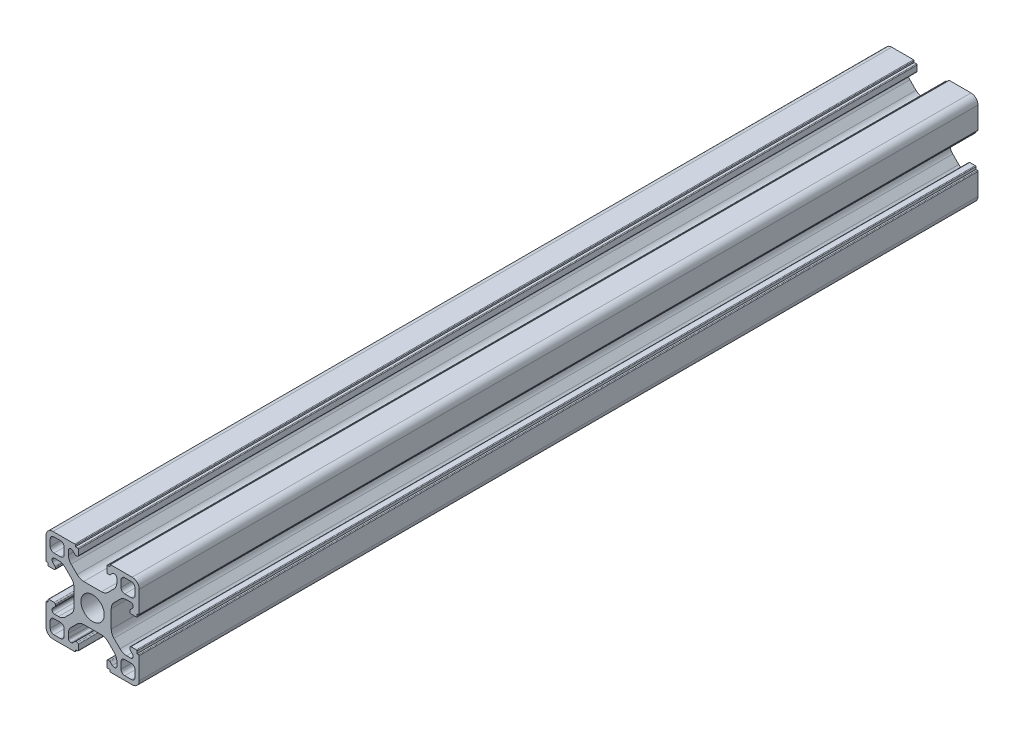
from build123d import *

# Parameters (mm, degrees)
EXTRUDE_1_DEPTH = 180


with BuildPart() as part:
    # Эскиз1 → Бобышка-Вытянуть1 (new body)
    with BuildSketch(Plane.XY):
        with BuildLine():
            Line((-31.105150957, 65.209647948), (-29.206370287, 65.209647948))
            ThreePointArc((-29.206370287, 65.209647948), (-28.441003423, 65.361888883), (-27.792156725, 65.795434385))
            Line((-27.792156725, 65.795434385), (-26.490937394, 67.096653716))
            ThreePointArc((-26.490937394, 67.096653716), (-26.057391892, 67.745500414), (-25.905150957, 68.510867279))
            Line((-25.905150957, 68.510867279), (-25.905150957, 69.409647948))
            ThreePointArc((-25.905150957, 69.409647948), (-26.051597566, 69.763201338), (-26.405150957, 69.909647948))
            Line((-26.405150957, 69.909647948), (-26.508044175, 69.909647948))
            ThreePointArc((-26.508044175, 69.909647948), (-26.699385892, 69.871587714), (-26.861597566, 69.763201338))
            Line((-26.861597566, 69.763201338), (-27.341927652, 69.282871252))
            ThreePointArc((-27.341927652, 69.282871252), (-27.423033489, 69.228678065), (-27.518704347, 69.209647948))
            Line((-27.518704347, 69.209647948), (-27.805150957, 69.209647948))
            ThreePointArc((-27.805150957, 69.209647948), (-27.981927652, 69.282871252), (-28.055150957, 69.459647948))
            Line((-28.055150957, 69.459647948), (-28.055150957, 70.608718768))
            ThreePointArc((-28.055150957, 70.608718768), (-28.011216974, 70.714784785), (-27.905150957, 70.758718768))
            Line((-27.905150957, 70.758718768), (-27.405150957, 70.758718768))
            Line((-27.405150957, 70.758718768), (-27.405150957, 71.059647948))
            ThreePointArc((-27.405150957, 71.059647948), (-27.361216974, 71.165713965), (-27.255150957, 71.209647948))
            Line((-27.255150957, 71.209647948), (-22.605150957, 71.209647948))
            ThreePointArc((-22.605150957, 71.209647948), (-21.544490785, 70.770308119), (-21.105150957, 69.709647948))
            Line((-21.105150957, 69.709647948), (-21.105150957, 65.059647948))
            ThreePointArc((-21.105150957, 65.059647948), (-21.149084939, 64.953581931), (-21.255150957, 64.909647948))
            Line((-21.255150957, 64.909647948), (-21.556080136, 64.909647948))
            Line((-21.556080136, 64.909647948), (-21.556080136, 64.409647948))
            ThreePointArc((-21.556080136, 64.409647948), (-21.600014119, 64.303581931), (-21.706080136, 64.259647948))
            Line((-21.706080136, 64.259647948), (-22.855150957, 64.259647948))
            ThreePointArc((-22.855150957, 64.259647948), (-23.031927652, 64.332871252), (-23.105150957, 64.509647948))
            Line((-23.105150957, 64.509647948), (-23.105150957, 64.796094557))
            ThreePointArc((-23.105150957, 64.796094557), (-23.08612084, 64.891765415), (-23.031927652, 64.972871252))
            Line((-23.031927652, 64.972871252), (-22.551597566, 65.453201338))
            ThreePointArc((-22.551597566, 65.453201338), (-22.44321119, 65.615413013), (-22.405150957, 65.806754729))
            Line((-22.405150957, 65.806754729), (-22.405150957, 65.909647948))
            ThreePointArc((-22.405150957, 65.909647948), (-22.551597566, 66.263201338), (-22.905150957, 66.409647948))
            Line((-22.905150957, 66.409647948), (-23.803931626, 66.409647948))
            ThreePointArc((-23.803931626, 66.409647948), (-24.56929849, 66.257407013), (-25.218145188, 65.82386151))
            Line((-25.218145188, 65.82386151), (-26.519364519, 64.522642179))
            ThreePointArc((-26.519364519, 64.522642179), (-26.952910022, 63.873795482), (-27.105150957, 63.108428617))
            Line((-27.105150957, 63.108428617), (-27.105150957, 61.209647948))
            Line((-27.105150957, 61.209647948), (-27.105150957, 59.310867279))
            ThreePointArc((-27.105150957, 59.310867279), (-26.952910022, 58.545500414), (-26.519364519, 57.896653716))
            Line((-26.519364519, 57.896653716), (-25.218145188, 56.595434385))
            ThreePointArc((-25.218145188, 56.595434385), (-24.56929849, 56.161888883), (-23.803931626, 56.009647948))
            Line((-23.803931626, 56.009647948), (-22.905150957, 56.009647948))
            ThreePointArc((-22.905150957, 56.009647948), (-22.551597566, 56.156094557), (-22.405150957, 56.509647948))
            Line((-22.405150957, 56.509647948), (-22.405150957, 56.612541166))
            ThreePointArc((-22.405150957, 56.612541166), (-22.44321119, 56.803882883), (-22.551597566, 56.966094557))
            Line((-22.551597566, 56.966094557), (-23.031927652, 57.446424643))
            ThreePointArc((-23.031927652, 57.446424643), (-23.08612084, 57.52753048), (-23.105150957, 57.623201338))
            Line((-23.105150957, 57.623201338), (-23.105150957, 57.909647948))
            ThreePointArc((-23.105150957, 57.909647948), (-23.031927652, 58.086424643), (-22.855150957, 58.159647948))
            Line((-22.855150957, 58.159647948), (-21.706080136, 58.159647948))
            ThreePointArc((-21.706080136, 58.159647948), (-21.600014119, 58.115713965), (-21.556080136, 58.009647948))
            Line((-21.556080136, 58.009647948), (-21.556080136, 57.509647948))
            Line((-21.556080136, 57.509647948), (-21.255150957, 57.509647948))
            ThreePointArc((-21.255150957, 57.509647948), (-21.149084939, 57.465713965), (-21.105150957, 57.359647948))
            Line((-21.105150957, 57.359647948), (-21.105150957, 52.709647948))
            ThreePointArc((-21.105150957, 52.709647948), (-21.544490785, 51.648987776), (-22.605150957, 51.209647948))
            Line((-22.605150957, 51.209647948), (-27.255150957, 51.209647948))
            ThreePointArc((-27.255150957, 51.209647948), (-27.361216974, 51.253581931), (-27.405150957, 51.359647948))
            Line((-27.405150957, 51.359647948), (-27.405150957, 51.660577127))
            Line((-27.405150957, 51.660577127), (-27.905150957, 51.660577127))
            ThreePointArc((-27.905150957, 51.660577127), (-28.011216974, 51.70451111), (-28.055150957, 51.810577127))
            Line((-28.055150957, 51.810577127), (-28.055150957, 52.959647948))
            ThreePointArc((-28.055150957, 52.959647948), (-27.981927652, 53.136424643), (-27.805150957, 53.209647948))
            Line((-27.805150957, 53.209647948), (-27.518704347, 53.209647948))
            ThreePointArc((-27.518704347, 53.209647948), (-27.423033489, 53.190617831), (-27.341927652, 53.136424643))
            Line((-27.341927652, 53.136424643), (-26.861597566, 52.656094557))
            ThreePointArc((-26.861597566, 52.656094557), (-26.699385892, 52.547708181), (-26.508044175, 52.509647948))
            Line((-26.508044175, 52.509647948), (-26.405150957, 52.509647948))
            ThreePointArc((-26.405150957, 52.509647948), (-26.051597566, 52.656094557), (-25.905150957, 53.009647948))
            Line((-25.905150957, 53.009647948), (-25.905150957, 53.908428617))
            ThreePointArc((-25.905150957, 53.908428617), (-26.057391892, 54.673795482), (-26.490937394, 55.322642179))
            Line((-26.490937394, 55.322642179), (-27.792156725, 56.62386151))
            ThreePointArc((-27.792156725, 56.62386151), (-28.441003423, 57.057407013), (-29.206370287, 57.209647948))
            Line((-29.206370287, 57.209647948), (-31.105150957, 57.209647948))
            Line((-31.105150957, 57.209647948), (-33.003931626, 57.209647948))
            ThreePointArc((-33.003931626, 57.209647948), (-33.76929849, 57.057407013), (-34.418145188, 56.62386151))
            Line((-34.418145188, 56.62386151), (-35.719364519, 55.322642179))
            ThreePointArc((-35.719364519, 55.322642179), (-36.152910022, 54.673795482), (-36.305150957, 53.908428617))
            Line((-36.305150957, 53.908428617), (-36.305150957, 53.009647948))
            ThreePointArc((-36.305150957, 53.009647948), (-36.158704347, 52.656094557), (-35.805150957, 52.509647948))
            Line((-35.805150957, 52.509647948), (-35.702257738, 52.509647948))
            ThreePointArc((-35.702257738, 52.509647948), (-35.510916022, 52.547708181), (-35.348704347, 52.656094557))
            Line((-35.348704347, 52.656094557), (-34.868374261, 53.136424643))
            ThreePointArc((-34.868374261, 53.136424643), (-34.787268424, 53.190617831), (-34.691597566, 53.209647948))
            Line((-34.691597566, 53.209647948), (-34.405150957, 53.209647948))
            ThreePointArc((-34.405150957, 53.209647948), (-34.228374261, 53.136424643), (-34.155150957, 52.959647948))
            Line((-34.155150957, 52.959647948), (-34.155150957, 51.810577127))
            ThreePointArc((-34.155150957, 51.810577127), (-34.199084939, 51.70451111), (-34.305150957, 51.660577127))
            Line((-34.305150957, 51.660577127), (-34.805150957, 51.660577127))
            Line((-34.805150957, 51.660577127), (-34.805150957, 51.359647948))
            ThreePointArc((-34.805150957, 51.359647948), (-34.849084939, 51.253581931), (-34.955150957, 51.209647948))
            Line((-34.955150957, 51.209647948), (-39.605150957, 51.209647948))
            ThreePointArc((-39.605150957, 51.209647948), (-40.665811128, 51.648987776), (-41.105150957, 52.709647948))
            Line((-41.105150957, 52.709647948), (-41.105150957, 57.359647948))
            ThreePointArc((-41.105150957, 57.359647948), (-41.061216974, 57.465713965), (-40.955150957, 57.509647948))
            Line((-40.955150957, 57.509647948), (-40.654221777, 57.509647948))
            Line((-40.654221777, 57.509647948), (-40.654221777, 58.009647948))
            ThreePointArc((-40.654221777, 58.009647948), (-40.610287794, 58.115713965), (-40.504221777, 58.159647948))
            Line((-40.504221777, 58.159647948), (-39.355150957, 58.159647948))
            ThreePointArc((-39.355150957, 58.159647948), (-39.178374261, 58.086424643), (-39.105150957, 57.909647948))
            Line((-39.105150957, 57.909647948), (-39.105150957, 57.623201338))
            ThreePointArc((-39.105150957, 57.623201338), (-39.124181073, 57.52753048), (-39.178374261, 57.446424643))
            Line((-39.178374261, 57.446424643), (-39.658704347, 56.966094557))
            ThreePointArc((-39.658704347, 56.966094557), (-39.767090723, 56.803882883), (-39.805150957, 56.612541166))
            Line((-39.805150957, 56.612541166), (-39.805150957, 56.509647948))
            ThreePointArc((-39.805150957, 56.509647948), (-39.658704347, 56.156094557), (-39.305150957, 56.009647948))
            Line((-39.305150957, 56.009647948), (-38.406370287, 56.009647948))
            ThreePointArc((-38.406370287, 56.009647948), (-37.641003423, 56.161888883), (-36.992156725, 56.595434385))
            Line((-36.992156725, 56.595434385), (-35.690937394, 57.896653716))
            ThreePointArc((-35.690937394, 57.896653716), (-35.257391892, 58.545500414), (-35.105150957, 59.310867279))
            Line((-35.105150957, 59.310867279), (-35.105150957, 61.209647948))
            Line((-35.105150957, 61.209647948), (-35.105150957, 63.108428617))
            ThreePointArc((-35.105150957, 63.108428617), (-35.257391892, 63.873795482), (-35.690937394, 64.522642179))
            Line((-35.690937394, 64.522642179), (-36.992156725, 65.82386151))
            ThreePointArc((-36.992156725, 65.82386151), (-37.641003423, 66.257407013), (-38.406370287, 66.409647948))
            Line((-38.406370287, 66.409647948), (-39.305150957, 66.409647948))
            ThreePointArc((-39.305150957, 66.409647948), (-39.658704347, 66.263201338), (-39.805150957, 65.909647948))
            Line((-39.805150957, 65.909647948), (-39.805150957, 65.806754729))
            ThreePointArc((-39.805150957, 65.806754729), (-39.767090723, 65.615413013), (-39.658704347, 65.453201338))
            Line((-39.658704347, 65.453201338), (-39.178374261, 64.972871252))
            ThreePointArc((-39.178374261, 64.972871252), (-39.124181073, 64.891765415), (-39.105150957, 64.796094557))
            Line((-39.105150957, 64.796094557), (-39.105150957, 64.509647948))
            ThreePointArc((-39.105150957, 64.509647948), (-39.178374261, 64.332871252), (-39.355150957, 64.259647948))
            Line((-39.355150957, 64.259647948), (-40.504221777, 64.259647948))
            ThreePointArc((-40.504221777, 64.259647948), (-40.610287794, 64.303581931), (-40.654221777, 64.409647948))
            Line((-40.654221777, 64.409647948), (-40.654221777, 64.909647948))
            Line((-40.654221777, 64.909647948), (-40.955150957, 64.909647948))
            ThreePointArc((-40.955150957, 64.909647948), (-41.061216974, 64.953581931), (-41.105150957, 65.059647948))
            Line((-41.105150957, 65.059647948), (-41.105150957, 69.709647948))
            ThreePointArc((-41.105150957, 69.709647948), (-40.665811128, 70.770308119), (-39.605150957, 71.209647948))
            Line((-39.605150957, 71.209647948), (-34.955150957, 71.209647948))
            ThreePointArc((-34.955150957, 71.209647948), (-34.849084939, 71.165713965), (-34.805150957, 71.059647948))
            Line((-34.805150957, 71.059647948), (-34.805150957, 70.758718768))
            Line((-34.805150957, 70.758718768), (-34.305150957, 70.758718768))
            ThreePointArc((-34.305150957, 70.758718768), (-34.199084939, 70.714784785), (-34.155150957, 70.608718768))
            Line((-34.155150957, 70.608718768), (-34.155150957, 69.459647948))
            ThreePointArc((-34.155150957, 69.459647948), (-34.228374261, 69.282871252), (-34.405150957, 69.209647948))
            Line((-34.405150957, 69.209647948), (-34.691597566, 69.209647948))
            ThreePointArc((-34.691597566, 69.209647948), (-34.787268424, 69.228678065), (-34.868374261, 69.282871252))
            Line((-34.868374261, 69.282871252), (-35.348704347, 69.763201338))
            ThreePointArc((-35.348704347, 69.763201338), (-35.510916022, 69.871587714), (-35.702257738, 69.909647948))
            Line((-35.702257738, 69.909647948), (-35.805150957, 69.909647948))
            ThreePointArc((-35.805150957, 69.909647948), (-36.158704347, 69.763201338), (-36.305150957, 69.409647948))
            Line((-36.305150957, 69.409647948), (-36.305150957, 68.510867279))
            ThreePointArc((-36.305150957, 68.510867279), (-36.152910022, 67.745500414), (-35.719364519, 67.096653716))
            Line((-35.719364519, 67.096653716), (-34.418145188, 65.795434385))
            ThreePointArc((-34.418145188, 65.795434385), (-33.76929849, 65.361888883), (-33.003931626, 65.209647948))
            Line((-33.003931626, 65.209647948), (-31.105150957, 65.209647948))
        make_face()
        with BuildLine():
            Line((-24.205150957, 67.309647948), (-22.805150957, 67.309647948))
            ThreePointArc((-22.805150957, 67.309647948), (-22.239465532, 67.543962523), (-22.005150957, 68.109647948))
            Line((-22.005150957, 68.109647948), (-22.005150957, 69.509647948))
            ThreePointArc((-22.005150957, 69.509647948), (-22.239465532, 70.075333373), (-22.805150957, 70.309647948))
            Line((-22.805150957, 70.309647948), (-24.205150957, 70.309647948))
            ThreePointArc((-24.205150957, 70.309647948), (-24.770836381, 70.075333373), (-25.005150957, 69.509647948))
            Line((-25.005150957, 69.509647948), (-25.005150957, 68.109647948))
            ThreePointArc((-25.005150957, 68.109647948), (-24.770836381, 67.543962523), (-24.205150957, 67.309647948))
        make_face(mode=Mode.SUBTRACT)
        with BuildLine():
            Line((-25.005150957, 54.309647948), (-25.005150957, 52.909647948))
            ThreePointArc((-25.005150957, 52.909647948), (-24.770836381, 52.343962523), (-24.205150957, 52.109647948))
            Line((-24.205150957, 52.109647948), (-22.805150957, 52.109647948))
            ThreePointArc((-22.805150957, 52.109647948), (-22.239465532, 52.343962523), (-22.005150957, 52.909647948))
            Line((-22.005150957, 52.909647948), (-22.005150957, 54.309647948))
            ThreePointArc((-22.005150957, 54.309647948), (-22.239465532, 54.875333373), (-22.805150957, 55.109647948))
            Line((-22.805150957, 55.109647948), (-24.205150957, 55.109647948))
            ThreePointArc((-24.205150957, 55.109647948), (-24.770836381, 54.875333373), (-25.005150957, 54.309647948))
        make_face(mode=Mode.SUBTRACT)
        with BuildLine():
            Line((-38.005150957, 55.109647948), (-39.405150957, 55.109647948))
            ThreePointArc((-39.405150957, 55.109647948), (-39.970836381, 54.875333373), (-40.205150957, 54.309647948))
            Line((-40.205150957, 54.309647948), (-40.205150957, 52.909647948))
            ThreePointArc((-40.205150957, 52.909647948), (-39.970836381, 52.343962523), (-39.405150957, 52.109647948))
            Line((-39.405150957, 52.109647948), (-38.005150957, 52.109647948))
            ThreePointArc((-38.005150957, 52.109647948), (-37.439465532, 52.343962523), (-37.205150957, 52.909647948))
            Line((-37.205150957, 52.909647948), (-37.205150957, 54.309647948))
            ThreePointArc((-37.205150957, 54.309647948), (-37.439465532, 54.875333373), (-38.005150957, 55.109647948))
        make_face(mode=Mode.SUBTRACT)
        with BuildLine():
            Line((-37.205150957, 68.109647948), (-37.205150957, 69.509647948))
            ThreePointArc((-37.205150957, 69.509647948), (-37.439465532, 70.075333373), (-38.005150957, 70.309647948))
            Line((-38.005150957, 70.309647948), (-39.405150957, 70.309647948))
            ThreePointArc((-39.405150957, 70.309647948), (-39.970836381, 70.075333373), (-40.205150957, 69.509647948))
            Line((-40.205150957, 69.509647948), (-40.205150957, 68.109647948))
            ThreePointArc((-40.205150957, 68.109647948), (-39.970836381, 67.543962523), (-39.405150957, 67.309647948))
            Line((-39.405150957, 67.309647948), (-38.005150957, 67.309647948))
            ThreePointArc((-38.005150957, 67.309647948), (-37.439465532, 67.543962523), (-37.205150957, 68.109647948))
        make_face(mode=Mode.SUBTRACT)
        with BuildLine():
            ThreePointArc((-28.605150957, 61.209647948), (-29.337384004, 62.977414901), (-31.105150957, 63.709647948))
            ThreePointArc((-31.105150957, 63.709647948), (-32.87291791, 62.977414901), (-33.605150957, 61.209647948))
            ThreePointArc((-33.605150957, 61.209647948), (-32.87291791, 59.441880995), (-31.105150957, 58.709647948))
            ThreePointArc((-31.105150957, 58.709647948), (-29.337384004, 59.441880995), (-28.605150957, 61.209647948))
        make_face(mode=Mode.SUBTRACT)
    extrude(amount=EXTRUDE_1_DEPTH)


solid = part.part
